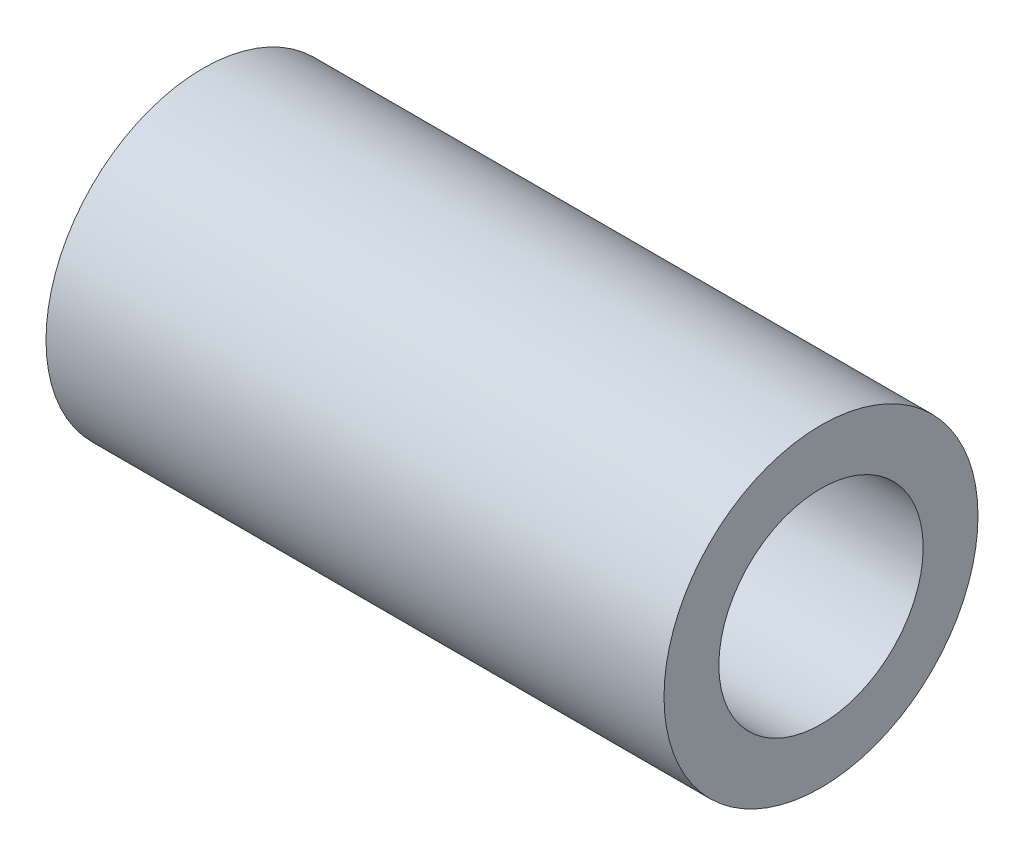
from build123d import *

# Parameters (mm, degrees)
CROQUIS1_W = 24.8
CROQUIS1_H = 2.2


with BuildPart() as part:
    # Croquis1 → Revolución1 (revolve)
    with BuildSketch(Plane.XY, mode=Mode.PRIVATE) as revoluci_n1_sk:
        with Locations((0, 5.2)):
            Rectangle(CROQUIS1_W, CROQUIS1_H)
    revolve(revoluci_n1_sk.sketch.rotate(Axis((-12.4, 0, 0), (1, 0, 0)), 90), axis=Axis((-12.4, 0, 0), (1, 0, 0)))


solid = part.part
